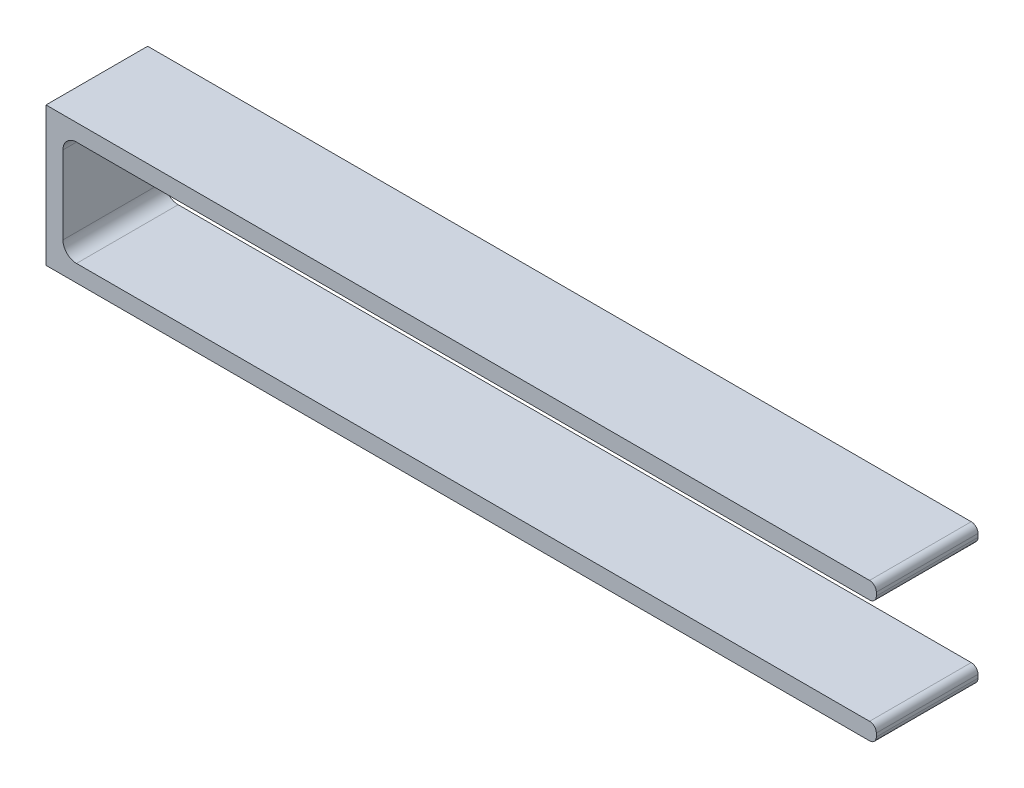
from build123d import *

# Parameters (mm, degrees)
BOSS_EXTRUDE1_DEPTH = 15
FILLET1_R           = 2


with BuildPart() as part:
    # Sketch1 → Boss-Extrude1 (new body)
    with BuildSketch(Plane.XY):
        with BuildLine():
            Line((0, 0), (0, 15.5))
            Line((0, 15.5), (119, 15.5))
            ThreePointArc((119, 15.5), (119.707106781, 15.792893219), (120, 16.5))
            Line((120, 16.5), (120, 17))
            ThreePointArc((120, 17), (119.707106781, 17.707106781), (119, 18))
            Line((119, 18), (-2.5, 18))
            Line((-2.5, 18), (-2.5, -2.5))
            Line((-2.5, -2.5), (119, -2.5))
            ThreePointArc((119, -2.5), (119.707106781, -2.207106781), (120, -1.5))
            Line((120, -1.5), (120, -1))
            ThreePointArc((120, -1), (119.707106781, -0.292893219), (119, 0))
            Line((119, 0), (0, 0))
        make_face()
    extrude(amount=BOSS_EXTRUDE1_DEPTH)

    # Fillet1
    fillet1_edges = [part.edges().sort_by_distance(p)[0] for p in [
        (0, 15.5, 7.5),
        (0, 0, 7.5),
    ]]
    fillet(fillet1_edges, radius=FILLET1_R)


solid = part.part
